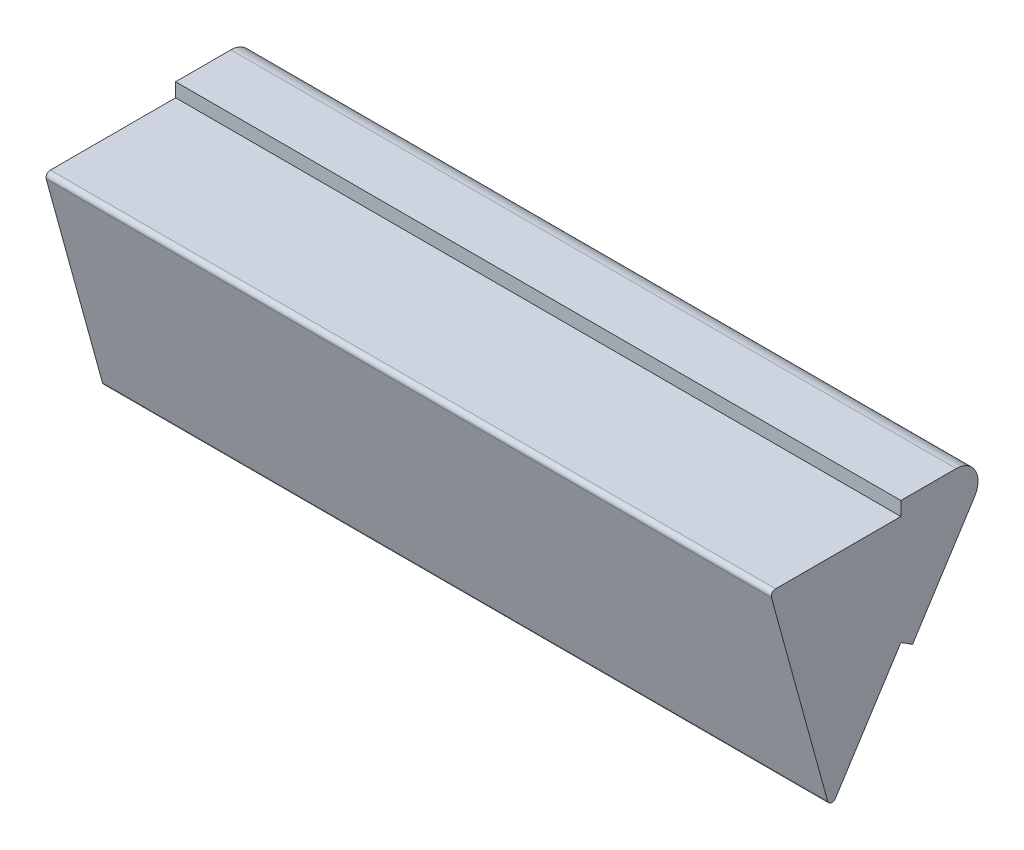
from build123d import *

# Parameters (mm, degrees)
BOSS_EXTRUDE1_DEPTH = 166.124


with BuildPart() as part:
    # Sketch1 → Boss-Extrude1 (new body)
    with BuildSketch(Plane(origin=(0, 0, 0), x_dir=(0, 0, -1), z_dir=(1, 0, 0))):
        with BuildLine():
            Line((1.31223354, 0), (30, 0))
            Line((30, 0), (30, 3.175))
            Line((30, 3.175), (42.665653227, 3.175))
            ThreePointArc((42.665653227, 3.175), (47.051803052, 0.575351996), (46.876974623, -4.520324118))
            Line((46.876974623, -4.520324118), (32.674189086, -26.711530815))
            Line((32.674189086, -26.711530815), (30, -25))
            Line((30, -25), (15.038789484, -48.376211248))
            ThreePointArc((15.038789484, -48.376211248), (14.046652384, -48.825851708), (13.232341269, -48.102380923))
            Line((13.232341269, -48.102380923), (0.348049605, -1.265234498))
            ThreePointArc((0.348049605, -1.265234498), (0.516861143, -0.393878931), (1.31223354, 0))
        make_face()
    extrude(amount=BOSS_EXTRUDE1_DEPTH)


solid = part.part
